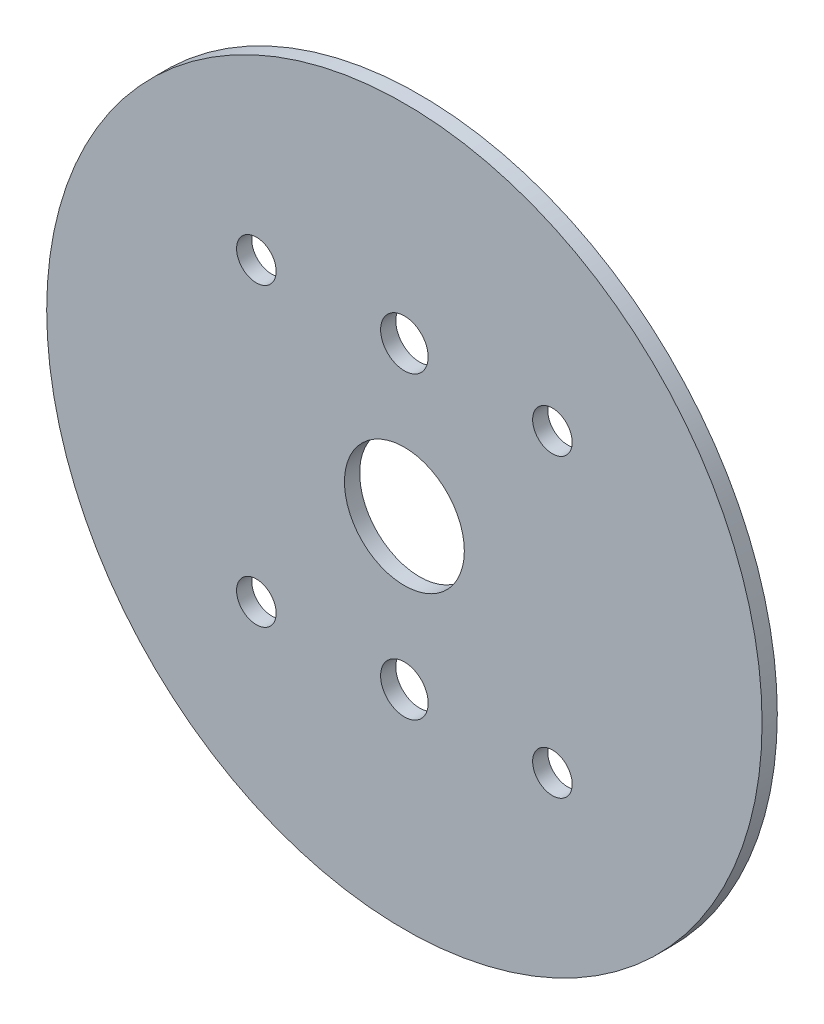
from build123d import *

# Parameters (mm, degrees)
SKETCH1_R           = 23.87
SKETCH1_R_2         = 1.5875
SKETCH1_R_3         = 1.3208
SKETCH1_R_4         = 4
BOSS_EXTRUDE2_DEPTH = 1.016


with BuildPart() as part:
    # Sketch1 → Boss-Extrude2 (new body)
    with BuildSketch(Plane.XY):
        Circle(SKETCH1_R)
        with Locations((0, 10)):
            Circle(SKETCH1_R_2, mode=Mode.SUBTRACT)
        with Locations((9.878281733, -9.878281733)):
            Circle(SKETCH1_R_3, mode=Mode.SUBTRACT)
        with Locations((9.878281733, 9.878281733)):
            Circle(SKETCH1_R_3, mode=Mode.SUBTRACT)
        with Locations((-9.878281733, -9.878281733)):
            Circle(SKETCH1_R_3, mode=Mode.SUBTRACT)
        with Locations((-9.878281733, 9.878281733)):
            Circle(SKETCH1_R_3, mode=Mode.SUBTRACT)
        Circle(SKETCH1_R_4, mode=Mode.SUBTRACT)
        with Locations((0, -10)):
            Circle(SKETCH1_R_2, mode=Mode.SUBTRACT)
    extrude(amount=BOSS_EXTRUDE2_DEPTH)


solid = part.part
